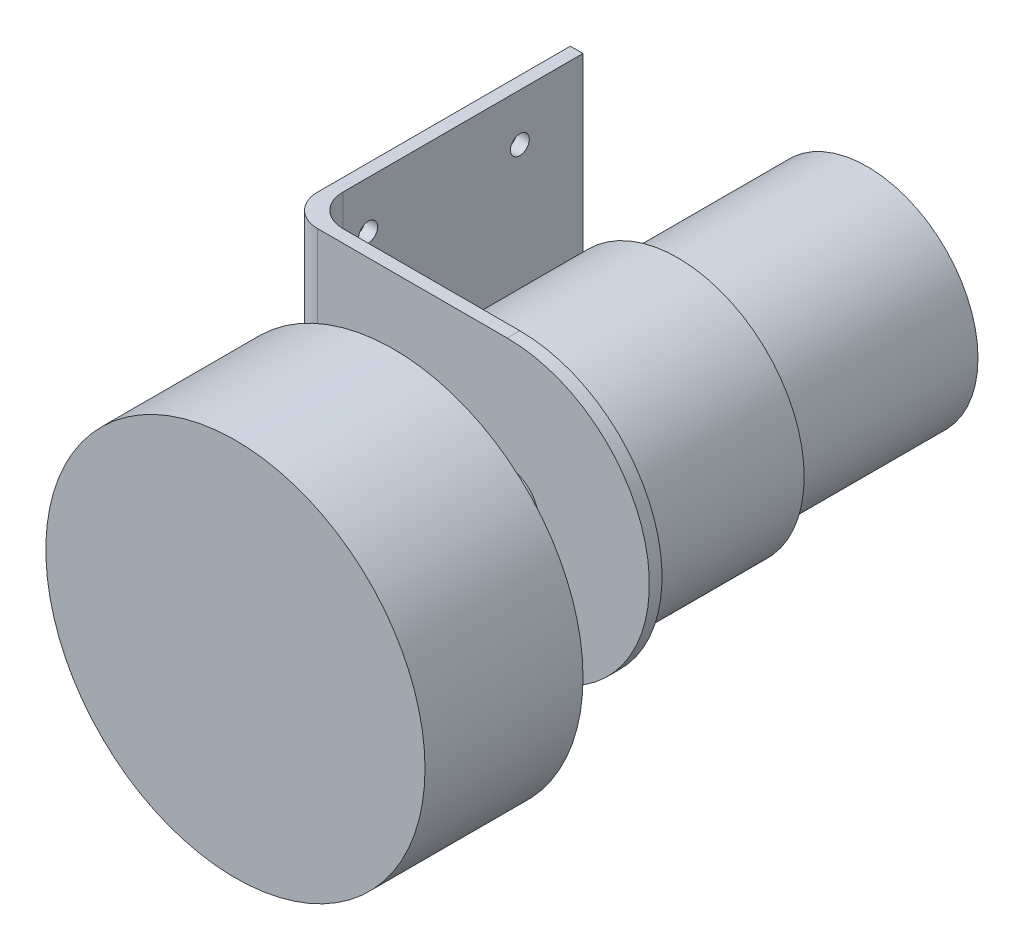
from build123d import *

# Parameters (mm, degrees)
SKETCH_1_R          = 17.5
EXTRUDE_1_DEPTH     = 30
SKETCH_2_R          = 20
EXTRUDE_2_DEPTH     = 25
SKETCH_3_R          = 5
EXTRUDE_3_DEPTH     = 100
SKETCH_4_R          = 30
EXTRUDE_4_DEPTH     = 25
EXTRUDE_5_DEPTH     = 2
SKETCH_7_W          = 2
SKETCH_7_H          = 45
EXTRUDE_6_DEPTH     = 45
FILLET_3_R          = 5
SKETCH_8_R          = 1.5
CUT_EXTRUDE_1_DEPTH = 5


with BuildPart() as part:
    # 草图1 → 凸台-拉伸1 (new body)
    with BuildSketch(Plane.XY):
        Circle(SKETCH_1_R)
    extrude(amount=EXTRUDE_1_DEPTH)

    # 草图2 → 凸台-拉伸2 (add)
    with BuildSketch(Plane.XY.offset(30)):
        Circle(SKETCH_2_R)
    extrude(amount=EXTRUDE_2_DEPTH)

    # 草图3 → 凸台-拉伸3 (add)
    with BuildSketch(Plane(origin=(0, 0, 0), x_dir=(-1, 0, 0), z_dir=(0, 0, -1))):
        Circle(SKETCH_3_R)
    extrude(amount=-EXTRUDE_3_DEPTH)

    # 草图4 → 凸台-拉伸4 (add)
    with BuildSketch(Plane.XY.offset(100)):
        Circle(SKETCH_4_R)
    extrude(amount=-EXTRUDE_4_DEPTH)

    # 草图6 → 凸台-拉伸5 (add)
    with BuildSketch(Plane.XY.offset(55)):
        with BuildLine():
            Line((0, 22.5), (-35, 22.5))
            Line((-35, 22.5), (-35, -22.5))
            Line((-35, -22.5), (0, -22.5))
            ThreePointArc((0, -22.5), (22.5, 0), (0, 22.5))
        make_face()
    extrude(amount=EXTRUDE_5_DEPTH)

    # 草图7 → 凸台-拉伸6 (add)
    with BuildSketch(Plane.XY.offset(57)):
        with Locations((-34, 0)):
            Rectangle(SKETCH_7_W, SKETCH_7_H)
    extrude(amount=-EXTRUDE_6_DEPTH)

    # 圆角3
    fillet_3_edges = [part.edges().sort_by_distance(p)[0] for p in [
        (-35, 0, 57),
        (-33, 0, 55),
    ]]
    fillet(fillet_3_edges, radius=FILLET_3_R)

    # 草图8 → 切除-拉伸1 (cut)
    with BuildSketch(Plane.ZY.offset(35)):
        with Locations((22, 15)):
            Circle(SKETCH_8_R)
        with Locations((22, -15)):
            Circle(SKETCH_8_R)
        with Locations((46, 15)):
            Circle(SKETCH_8_R)
        with Locations((46, -15)):
            Circle(SKETCH_8_R)
    extrude(amount=-CUT_EXTRUDE_1_DEPTH, mode=Mode.SUBTRACT)


solid = part.part
